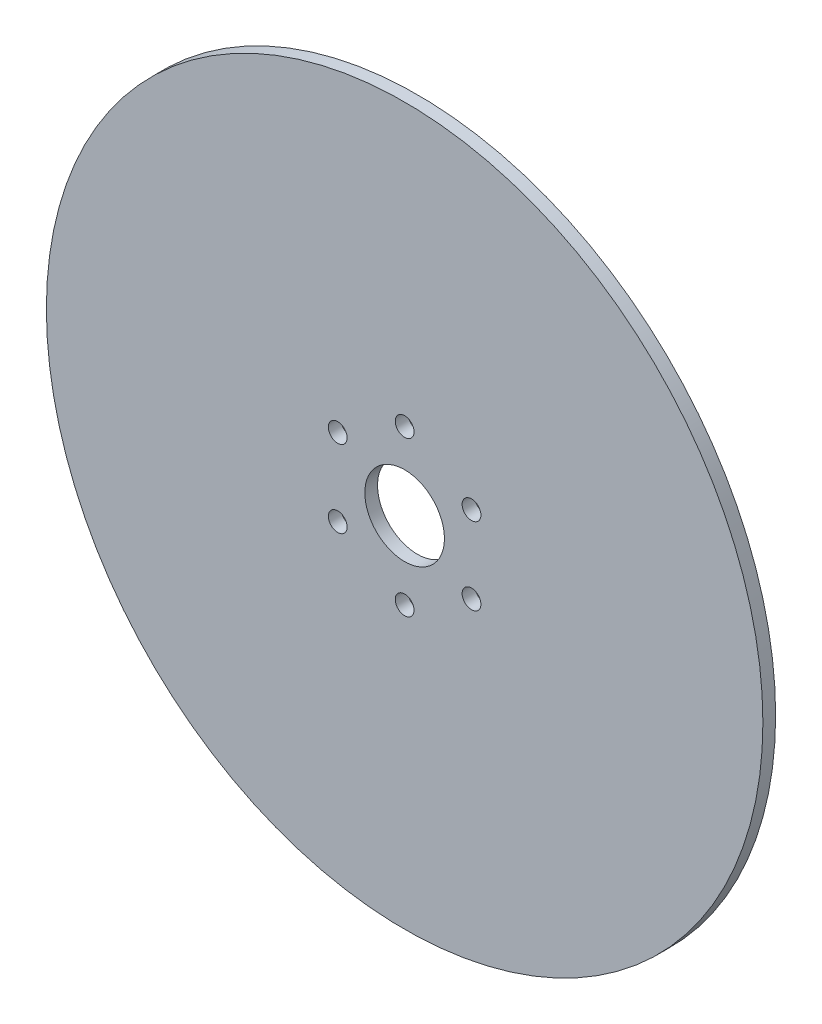
from build123d import *

# Parameters (mm, degrees)
SKETCH1_R               = 114.3
BOSS_EXTRUDE2_DEPTH     = 4.064
CUT_EXTRUDE1_DEPTH      = 70.612
CUT_EXTRUDE1_DEPTH_BACK = 101.6
SKETCH3_R               = 12.7
SKETCH4_R               = 2.9972
CUT_EXTRUDE3_DEPTH      = 70.612


with BuildPart() as part:
    # Sketch1 → Boss-Extrude2 (new body)
    with BuildSketch(Plane.XY):
        Circle(SKETCH1_R)
    extrude(amount=BOSS_EXTRUDE2_DEPTH)

    # Sketch3 → Cut-Extrude1 (cut, two sides: drawn at the far end of the back side and taken through both)
    with BuildSketch(Plane.XY.offset(4.064).offset(-CUT_EXTRUDE1_DEPTH_BACK)):
        Circle(SKETCH3_R)
    extrude(amount=CUT_EXTRUDE1_DEPTH + CUT_EXTRUDE1_DEPTH_BACK, mode=Mode.SUBTRACT)

    # Sketch4 → Cut-Extrude3 (cut)
    with BuildSketch(Plane.XY.offset(4.064)):
        with Locations((0, -24.638)):
            Circle(SKETCH4_R)
        with Locations((-21.337133898, -12.319)):
            Circle(SKETCH4_R)
        with Locations((-21.337133898, 12.319)):
            Circle(SKETCH4_R)
        with Locations((0, 24.638)):
            Circle(SKETCH4_R)
        with Locations((21.337133898, 12.319)):
            Circle(SKETCH4_R)
        with Locations((21.337133898, -12.319)):
            Circle(SKETCH4_R)
    extrude(amount=-CUT_EXTRUDE3_DEPTH, mode=Mode.SUBTRACT)


solid = part.part
